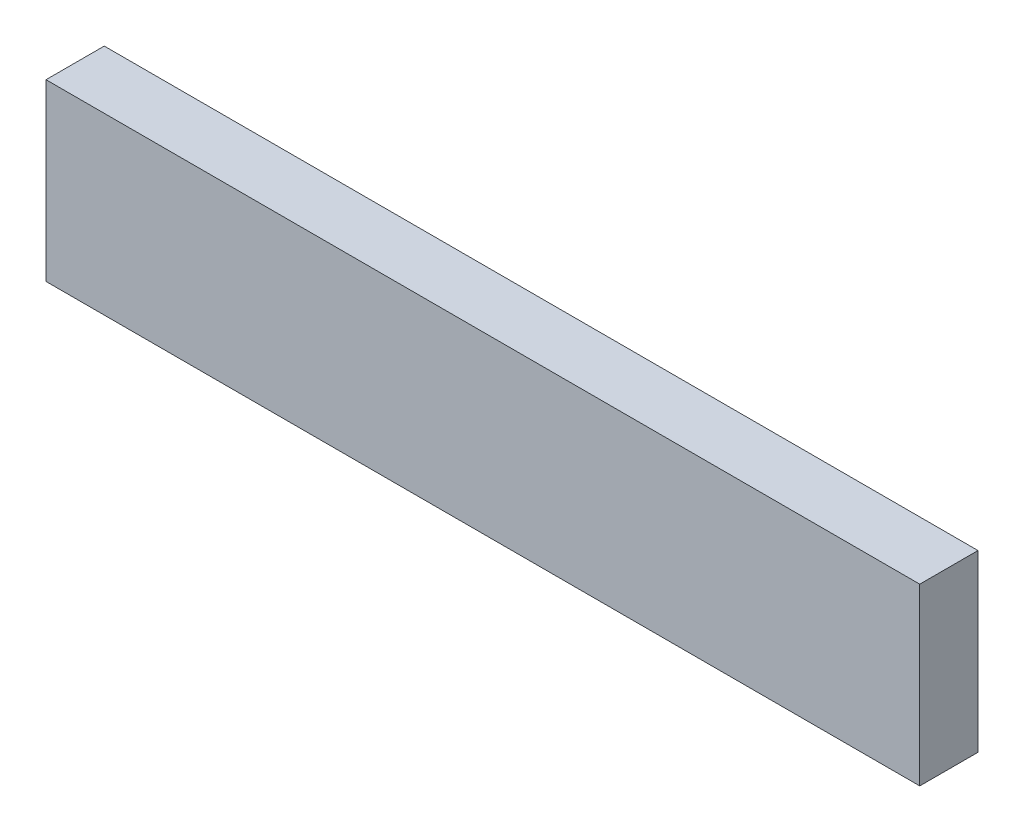
from build123d import *

# Parameters (mm, degrees)
SKETCH1_W           = 45
SKETCH1_H           = 9
BOSS_EXTRUDE1_DEPTH = 3


with BuildPart() as part:
    # Sketch1 → Boss-Extrude1 (new body)
    with BuildSketch(Plane.XY):
        Rectangle(SKETCH1_W, SKETCH1_H)
    extrude(amount=BOSS_EXTRUDE1_DEPTH)


solid = part.part
